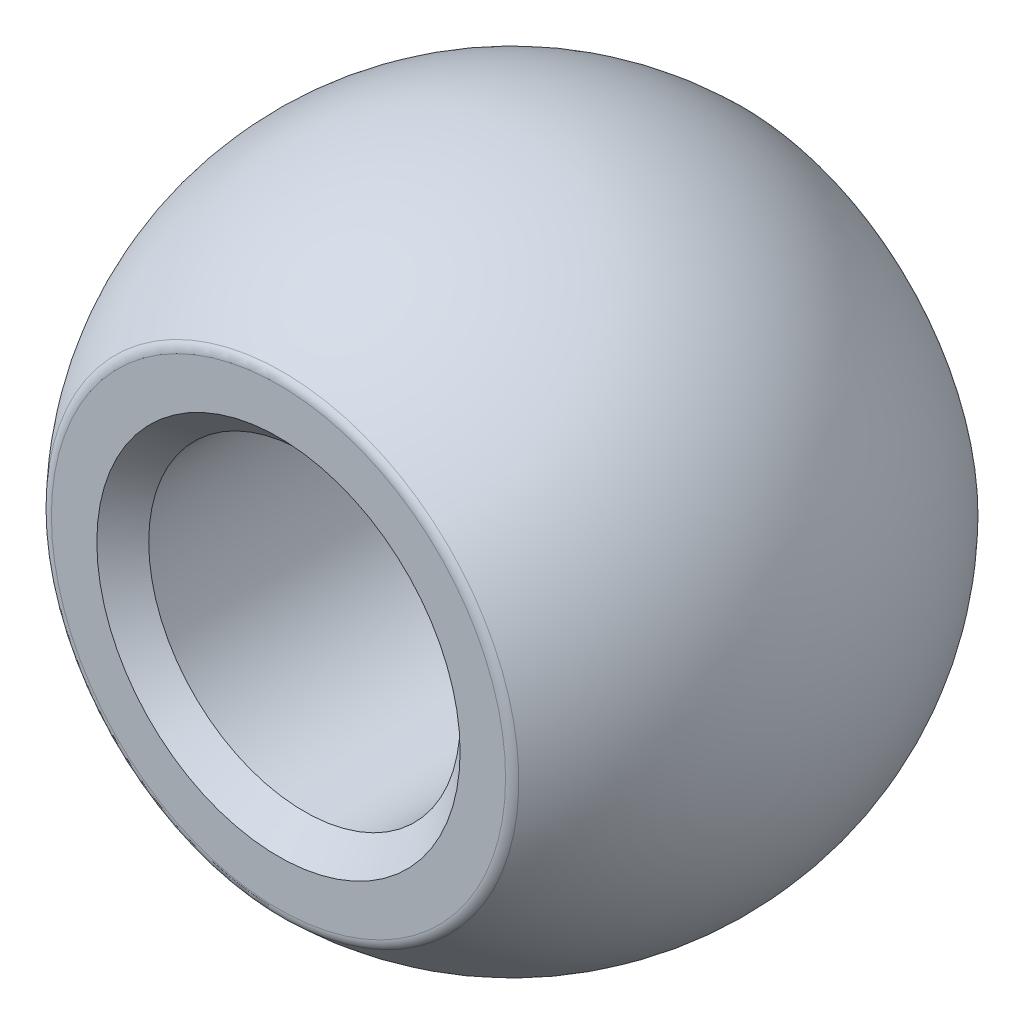
from build123d import *

# Parameters (mm, degrees)
CORTAR_EXTRUIR1_DEPTH      = 11.998522628
CORTAR_EXTRUIR1_DEPTH_BACK = 11.998522628
CROQUIS2_R                 = 3
CORTAR_EXTRUIR2_DEPTH      = 11.998522628
CORTAR_EXTRUIR2_DEPTH_BACK = 11.998522628
CROQUIS3_W                 = 1.096650784
CROQUIS3_H                 = 12.7
REDONDEO1_R                = 0.25
CHAFL_N1_SIZE              = 0.5


with BuildPart() as part:
    # Croquis1 → Revolución1 (revolve)
    with BuildSketch(Plane.XY):
        with BuildLine():
            Line((0, 6.35), (0, -6.35))
            ThreePointArc((0, -6.35), (-6.35, 0), (0, 6.35))
        make_face()
    revolve(axis=Axis((0, 6.35, 0), (0, -1, 0)))

    # Croquis2 → Cortar-Extruir1 (cut, two sides: drawn at the far end of the back side and taken through both)
    with BuildSketch(Plane.XY.offset(-CORTAR_EXTRUIR1_DEPTH_BACK)):
        with Locations(Location((0, 0, 0), (0, 0, 180))):
            Circle(CROQUIS2_R)
    extrude(amount=CORTAR_EXTRUIR1_DEPTH + CORTAR_EXTRUIR1_DEPTH_BACK, mode=Mode.SUBTRACT)

    # Croquis3 → Cortar-Extruir2 (cut, two sides: drawn at the far end of the back side and taken through both)
    with BuildSketch(Plane(origin=(0, 0, 0), x_dir=(0, 0, -1), z_dir=(1, 0, 0)).offset(-CORTAR_EXTRUIR2_DEPTH_BACK)):
        with Locations((5.048325392, 0)):
            Rectangle(CROQUIS3_W, CROQUIS3_H)
        with Locations((-5.048325392, 0)):
            Rectangle(CROQUIS3_W, CROQUIS3_H)
    extrude(amount=CORTAR_EXTRUIR2_DEPTH + CORTAR_EXTRUIR2_DEPTH_BACK, mode=Mode.SUBTRACT)

    # Redondeo1
    redondeo1_edges = [part.edges().sort_by_distance(p)[0] for p in [
        (0, -4.480234369, 4.5),
        (0, 4.480234369, -4.5),
    ]]
    fillet(redondeo1_edges, radius=REDONDEO1_R)

    # Chaflán1
    chafl_n1_edges = [part.edges().sort_by_distance(p)[0] for p in [
        (3, 0, 4.5),
        (3, 0, -4.5),
    ]]
    chamfer(chafl_n1_edges, length=CHAFL_N1_SIZE)


solid = part.part
